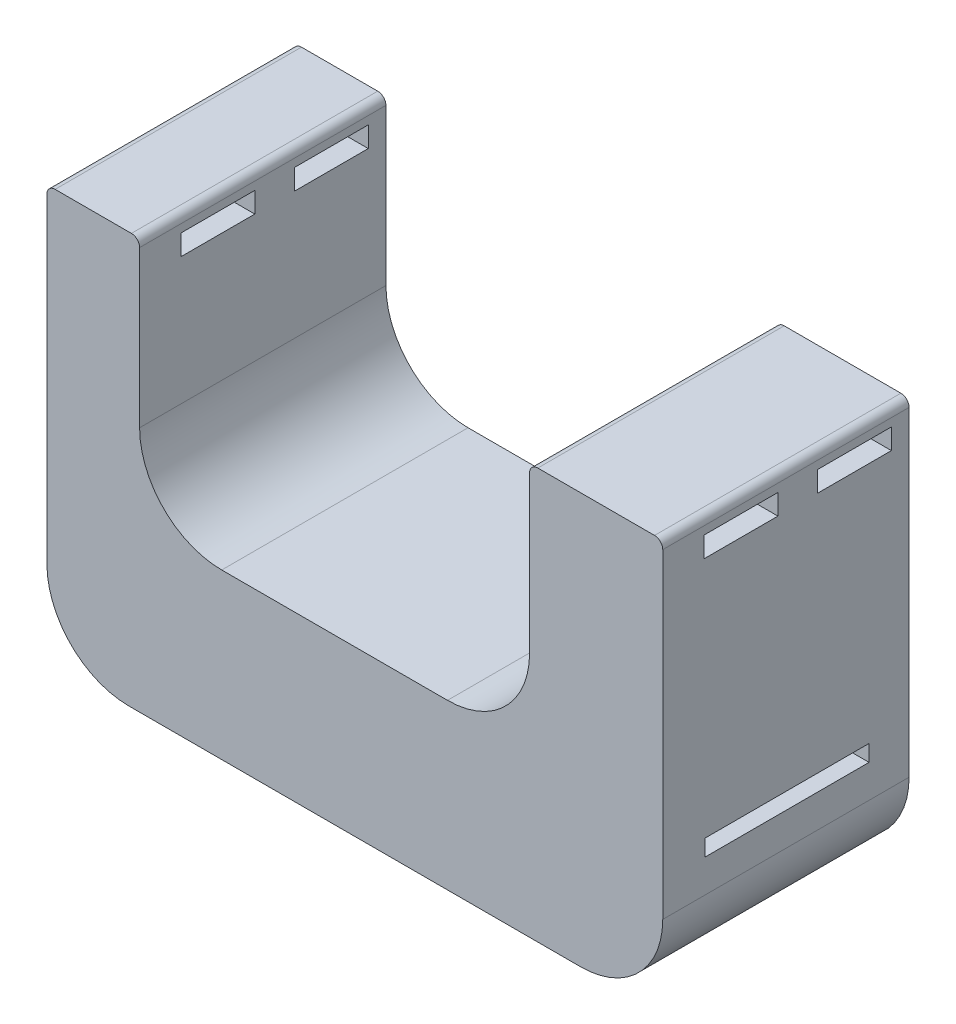
from build123d import *

# Parameters (mm, degrees)
SKETCH1_W           = 190.5
SKETCH1_H           = 76.2
BOSS_EXTRUDE1_DEPTH = 50.8
SKETCH2_W           = 28.67365349
SKETCH2_H           = 76.2
SKETCH2_W_2         = 41.184262463
BOSS_EXTRUDE2_DEPTH = 76.2
FILLET1_R           = 25.4
SKETCH4_W           = 22.86
SKETCH4_H           = 6.35
CUT_EXTRUDE1_DEPTH  = 210.380189247
FILLET2_R           = 2.54
SKETCH5_W           = 63.5
SKETCH5_H           = 60.96
CUT_EXTRUDE3_DEPTH  = 40.64
SKETCH7_W           = 50.8
SKETCH7_H           = 5.08
CUT_EXTRUDE4_DEPTH  = 76.2


with BuildPart() as part:
    # Sketch1 → Boss-Extrude1 (new body)
    with BuildSketch(Plane(origin=(0, 0, 0), x_dir=(1, 0, 0), z_dir=(0, 1, 0))):
        with Locations((8.93730635, -3.65372617)):
            Rectangle(SKETCH1_W, SKETCH1_H)
    extrude(amount=-BOSS_EXTRUDE1_DEPTH)

    # Sketch2 → Boss-Extrude2 (add)
    with BuildSketch(Plane(origin=(0, 0, 0), x_dir=(1, 0, 0), z_dir=(0, 1, 0))):
        with Locations((-71.975866905, -3.65372617)):
            Rectangle(SKETCH2_W, SKETCH2_H)
        with Locations((83.595175119, -3.65372617)):
            Rectangle(SKETCH2_W_2, SKETCH2_H)
    extrude(amount=BOSS_EXTRUDE2_DEPTH)

    # Fillet1
    fillet1_edges = [part.edges().sort_by_distance(p)[0] for p in [
        (104.18730635, -50.8, 3.65372617),
        (-57.63904016, 0, 3.65372617),
        (63.003043887, 0, 3.65372617),
        (-86.31269365, -50.8, 3.65372617),
    ]]
    fillet(fillet1_edges, radius=FILLET1_R)

    # Sketch4 → Cut-Extrude1 (cut, symmetric)
    with BuildSketch(Plane.ZY.offset(86.31269365)):
        with Locations((-17.548825197, 68.000163991)):
            Rectangle(SKETCH4_W, SKETCH4_H)
    cut_extrude1 = extrude(amount=CUT_EXTRUDE1_DEPTH, both=True, mode=Mode.SUBTRACT)

    # Mirror1: Cut-Extrude1 across plane
    add(cut_extrude1.mirror(Plane.XY), mode=Mode.SUBTRACT)

    # Fillet2
    fillet2_edges = [part.edges().sort_by_distance(p)[0] for p in [
        (-86.31269365, 76.2, 3.65372617),
        (-57.63904016, 76.2, 3.65372617),
        (104.18730635, 76.2, 3.65372617),
        (63.003043887, 76.2, 3.65372617),
    ]]
    fillet(fillet2_edges, radius=FILLET2_R)

    # Sketch5 → Cut-Extrude3 (cut)
    with BuildSketch(Plane.XZ.offset(50.8)):
        with Locations((6.612576952, 3.481502269)):
            Rectangle(SKETCH5_W, SKETCH5_H)
    extrude(amount=-CUT_EXTRUDE3_DEPTH, mode=Mode.SUBTRACT)

    # Sketch7 → Cut-Extrude4 (cut)
    with BuildSketch(Plane.ZY.offset(-38.362576952)):
        with Locations((3.329763468, -12.7)):
            Rectangle(SKETCH7_W, SKETCH7_H)
    extrude(amount=-CUT_EXTRUDE4_DEPTH, mode=Mode.SUBTRACT)


solid = part.part
